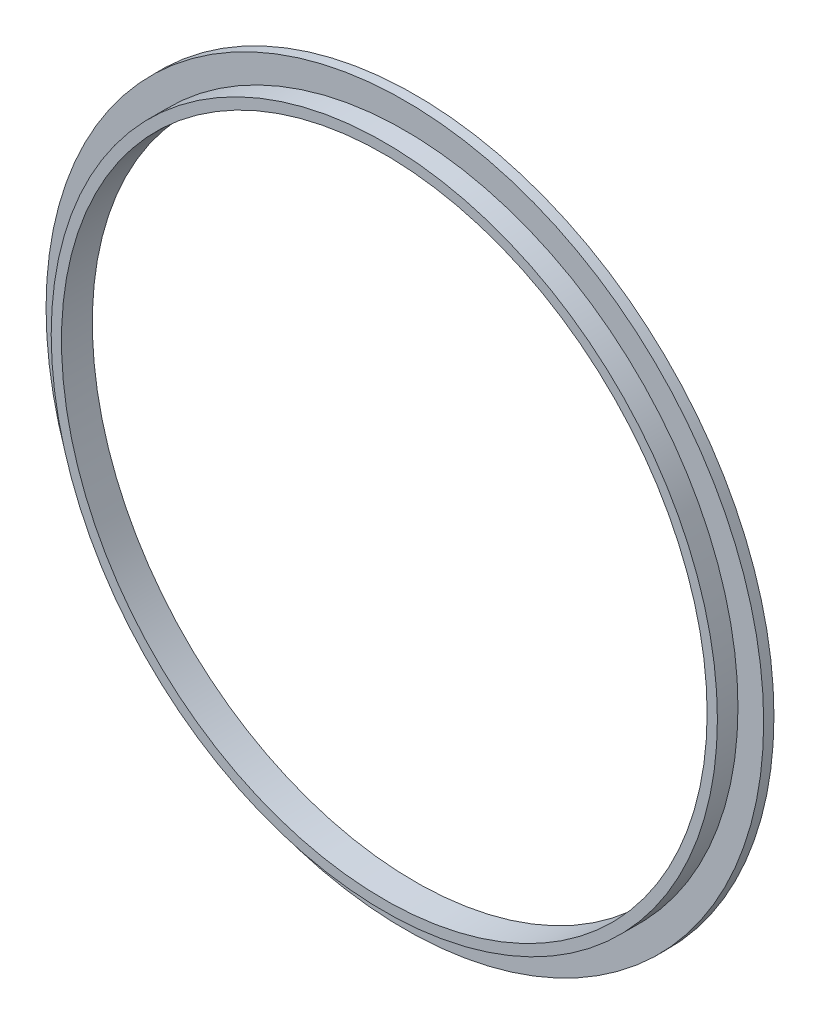
from build123d import *

# Parameters (mm, degrees)
SKETCH1_R           = 69.8
SKETCH1_R_2         = 62.8
BOSS_EXTRUDE1_DEPTH = 2
SKETCH2_R           = 64.8
SKETCH2_R_2         = 62.8
BOSS_EXTRUDE2_DEPTH = 4


with BuildPart() as part:
    # Sketch1 → Boss-Extrude1 (new body)
    with BuildSketch(Plane.XY):
        Circle(SKETCH1_R)
        Circle(SKETCH1_R_2, mode=Mode.SUBTRACT)
    extrude(amount=BOSS_EXTRUDE1_DEPTH)

    # Sketch2 → Boss-Extrude2 (add)
    with BuildSketch(Plane.XY.offset(2)):
        Circle(SKETCH2_R)
        Circle(SKETCH2_R_2, mode=Mode.SUBTRACT)
    extrude(amount=BOSS_EXTRUDE2_DEPTH)


solid = part.part
